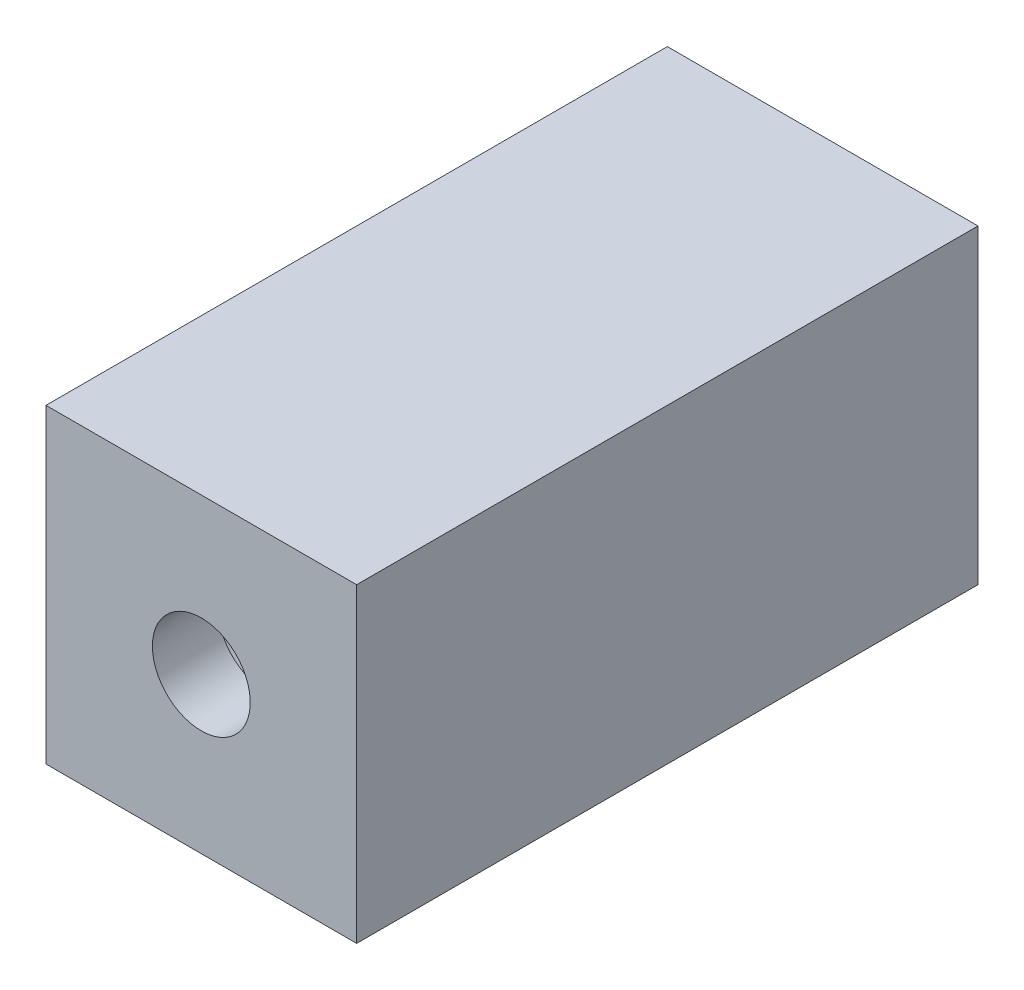
from build123d import *

# Parameters (mm, degrees)
SKETCH1_W           = 50.8
SKETCH1_H           = 25.4
BOSS_EXTRUDE1_DEPTH = 25.4
SKETCH2_R           = 4
CUT_EXTRUDE1_DEPTH  = 50.8
SKETCH3_W           = 10
SKETCH3_H           = 38.541538457


with BuildPart() as part:
    # Sketch1 → Boss-Extrude1 (new body)
    with BuildSketch(Plane(origin=(0, 0, 0), x_dir=(0, 0, -1), z_dir=(1, 0, 0))):
        Rectangle(SKETCH1_W, SKETCH1_H)
    extrude(amount=BOSS_EXTRUDE1_DEPTH)

    # Sketch2 → Cut-Extrude1 (cut)
    with BuildSketch(Plane(origin=(0, 0, -25.4), x_dir=(-1, 0, 0), z_dir=(0, 0, -1))):
        with Locations((-12.7, 0)):
            Circle(SKETCH2_R)
    extrude(amount=-CUT_EXTRUDE1_DEPTH, mode=Mode.SUBTRACT)

    # Sketch3 → Cut-Revolve2 (revolve, cut)
    with BuildSketch(Plane(origin=(0, 0, 0), x_dir=(1, 0, 0), z_dir=(0, 1, 0)), mode=Mode.PRIVATE) as cut_revolve2_sk:
        with Locations((17.7, -0.758930583)):
            Rectangle(SKETCH3_W, SKETCH3_H)
    revolve(cut_revolve2_sk.sketch.rotate(Axis((12.7, 0, 25.4), (0, 0, -1)), 180), axis=Axis((12.7, 0, 25.4), (0, 0, -1)), mode=Mode.SUBTRACT)


solid = part.part
